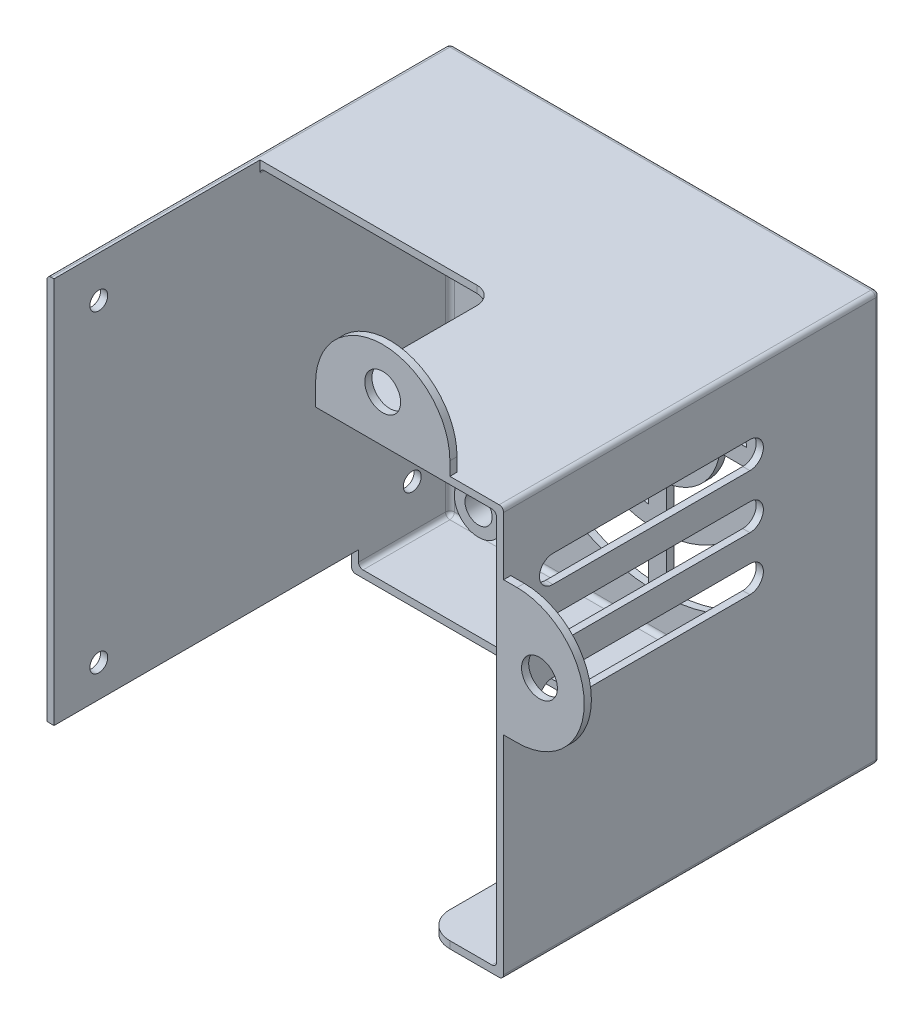
from build123d import *

# Parameters (mm, degrees)
CROQUIS1_W                        = 48
CROQUIS1_H                        = 45.7
SALIENTE_EXTRUIR1_DEPTH           = 42
CROQUIS2_W                        = 27
CROQUIS2_H                        = 20
CORTAR_EXTRUIR1_DEPTH             = 68.102458971
CROQUIS3_W                        = 0.8
CROQUIS3_H                        = 43.2
SALIENTE_EXTRUIR2_DEPTH           = 23
CROQUIS4_W                        = 27
CROQUIS4_H                        = 2.5
CORTAR_EXTRUIR2_DEPTH             = 11
CORTAR_EXTRUIR3_REACH             = 70.493
CROQUIS6_W                        = 26.2
CROQUIS6_H                        = 11
CROQUIS7_W                        = 31
CROQUIS7_H                        = 44.9
CORTAR_EXTRUIR4_DEPTH             = 12
CROQUIS8_W                        = 38.2
CROQUIS8_H                        = 44.1
CORTAR_EXTRUIR5_DEPTH             = 10.2
CORTAR_EXTRUIR6_REACH             = 71.353
CROQUIS9_W                        = 41.2
CROQUIS9_H                        = 44.1
CORTAR_EXTRUIR7_DEPTH             = 57.221437193
CORTAR_EXTRUIR8_DEPTH             = 57.221437193
CORTAR_EXTRUIR9_DEPTH             = 57.221437193
CORTAR_EXTRUIR10_DEPTH            = 57.221437193
CORTAR_EXTRUIR11_DEPTH            = 57.221437193
CORTAR_EXTRUIR12_DEPTH            = 57.221437193
CORTAR_EXTRUIR13_DEPTH            = 57.221437193
CORTAR_EXTRUIR14_REACH            = 71.9
CORTAR_EXTRUIR15_REACH            = 71.9
CORTAR_EXTRUIR16_REACH            = 71.9
CORTAR_EXTRUIR17_DEPTH            = 57.852528528
SALIENTE_EXTRUIR3_DEPTH           = 0.8
SALIENTE_EXTRUIR4_DEPTH           = 0.8
DI_METRO_DE_TALADRO_2_0_2_1_D     = 2
DI_METRO_DE_TALADRO_2_0_2_1_DEPTH = 0.8
DI_METRO_DE_TALADRO_4_0_4_1_D     = 4
DI_METRO_DE_TALADRO_4_0_4_1_DEPTH = 42
REDONDEO1_R                       = 0.5
REDONDEO2_R                       = 2
REDONDEO3_R                       = 3
CROQUIS33_R                       = 2.7
CROQUIS33_R_2                     = 1.5
SALIENTE_EXTRUIR5_DEPTH           = 4
SALIENTE_EXTRUIR5_2_DEPTH         = 4
CROQUIS33_R_3                     = 1.516813283
SALIENTE_EXTRUIR5_3_DEPTH         = 4
SALIENTE_EXTRUIR5_4_DEPTH         = 4


with BuildPart() as part:
    # Croquis1 → Saliente-Extruir1 (new body)
    with BuildSketch(Plane.XY.offset(42)):
        with Locations((-1.5, 0.75)):
            Rectangle(CROQUIS1_W, CROQUIS1_H)
    extrude(amount=-SALIENTE_EXTRUIR1_DEPTH)

    # Croquis2 → Cortar-Extruir1 (cut, through all)
    with BuildSketch(Plane(origin=(0, 23.6, 0), x_dir=(-1, 0, 0), z_dir=(0, 1, 0))):
        with Locations((12, 32)):
            Rectangle(CROQUIS2_W, CROQUIS2_H)
    extrude(amount=-CORTAR_EXTRUIR1_DEPTH, mode=Mode.SUBTRACT)

    # Croquis3 → Saliente-Extruir2 (add)
    with BuildSketch(Plane.XY.offset(22)):
        with Locations((-25.1, 2)):
            Rectangle(CROQUIS3_W, CROQUIS3_H)
    extrude(amount=SALIENTE_EXTRUIR2_DEPTH)

    # Croquis4 → Cortar-Extruir2 (cut)
    with BuildSketch(Plane.XY.offset(22)):
        with Locations((-12, -20.85)):
            Rectangle(CROQUIS4_W, CROQUIS4_H)
    extrude(amount=-CORTAR_EXTRUIR2_DEPTH, mode=Mode.SUBTRACT)

    # Croquis6 → Cortar-Extruir3 (cut, up to next)
    with BuildSketch(Plane(origin=(0, 22.8, 0), x_dir=(1, 0, 0), z_dir=(0, 1, 0)), mode=Mode.PRIVATE) as cortar_extruir3_sk1:
        with Locations((-11.6, -16.5)):
            Rectangle(CROQUIS6_W, CROQUIS6_H)
    cortar_extruir3_tool1 = extrude(cortar_extruir3_sk1.sketch, amount=-CORTAR_EXTRUIR3_REACH, mode=Mode.PRIVATE) & part.part
    add(cortar_extruir3_tool1.solids().sort_by_distance((-11.6, 22.8, 16.5))[0], mode=Mode.SUBTRACT)

    # Croquis7 → Cortar-Extruir4 (cut)
    with BuildSketch(Plane.ZY.offset(-1.5)):
        with Locations((26.5, 0.35)):
            Rectangle(CROQUIS7_W, CROQUIS7_H)
    extrude(amount=-CORTAR_EXTRUIR4_DEPTH, mode=Mode.SUBTRACT)

    # Croquis8 → Cortar-Extruir5 (cut)
    with BuildSketch(Plane.XY.offset(11)):
        with Locations((-5.6, 0.75)):
            Rectangle(CROQUIS8_W, CROQUIS8_H)
    extrude(amount=-CORTAR_EXTRUIR5_DEPTH, mode=Mode.SUBTRACT)

    # Croquis9 → Cortar-Extruir6 (cut, up to next)
    with BuildSketch(Plane(origin=(21.7, 0, 0), x_dir=(0, 0, -1), z_dir=(1, 0, 0)), mode=Mode.PRIVATE) as cortar_extruir6_sk1:
        with Locations((-21.4, 0.75)):
            Rectangle(CROQUIS9_W, CROQUIS9_H)
    cortar_extruir6_tool1 = extrude(cortar_extruir6_sk1.sketch, amount=-CORTAR_EXTRUIR6_REACH, mode=Mode.PRIVATE) & part.part
    add(cortar_extruir6_tool1.solids().sort_by_distance((21.7, 0.75, 21.4))[0], mode=Mode.SUBTRACT)

    # Croquis10 → Cortar-Extruir7 (cut, through all)
    with BuildSketch(Plane.XY.offset(0.8)):
        with BuildLine():
            Line((-0.5, -6.17820323), (-0.5, -9.199874371))
            ThreePointArc((-0.5, -9.199874371), (5.571067812, -6.321067812), (8.449874371, -0.25))
            Line((8.449874371, -0.25), (5.42820323, -0.25))
            ThreePointArc((5.42820323, -0.25), (3.449747468, -4.199747468), (-0.5, -6.17820323))
        make_face()
    extrude(amount=-CORTAR_EXTRUIR7_DEPTH, mode=Mode.SUBTRACT)

    # Croquis11 → Cortar-Extruir8 (cut, through all)
    with BuildSketch(Plane.XY.offset(0.8)):
        with BuildLine():
            Line((-0.5, -11.208260743), (-0.5, -17.222200756))
            ThreePointArc((-0.5, -17.222200756), (11.227922061, -11.977922061), (16.472200756, -0.25))
            Line((16.472200756, -0.25), (10.458260743, -0.25))
            ThreePointArc((10.458260743, -0.25), (6.985281374, -7.735281374), (-0.5, -11.208260743))
        make_face()
    extrude(amount=-CORTAR_EXTRUIR8_DEPTH, mode=Mode.SUBTRACT)

    # Croquis12 → Cortar-Extruir9 (cut, through all)
    with BuildSketch(Plane.XY.offset(0.8)):
        with BuildLine():
            Line((-8.42820323, -0.25), (-11.449874371, -0.25))
            ThreePointArc((-11.449874371, -0.25), (-8.571067812, -6.321067812), (-2.5, -9.199874371))
            Line((-2.5, -9.199874371), (-2.5, -6.17820323))
            ThreePointArc((-2.5, -6.17820323), (-6.449747468, -4.199747468), (-8.42820323, -0.25))
        make_face()
    extrude(amount=-CORTAR_EXTRUIR9_DEPTH, mode=Mode.SUBTRACT)

    # Croquis13 → Cortar-Extruir10 (cut, through all)
    with BuildSketch(Plane.XY.offset(0.8)):
        with BuildLine():
            Line((-13.458260743, -0.25), (-19.472200756, -0.25))
            ThreePointArc((-19.472200756, -0.25), (-14.227922061, -11.977922061), (-2.5, -17.222200756))
            Line((-2.5, -17.222200756), (-2.5, -11.208260743))
            ThreePointArc((-2.5, -11.208260743), (-9.985281374, -7.735281374), (-13.458260743, -0.25))
        make_face()
    extrude(amount=-CORTAR_EXTRUIR10_DEPTH, mode=Mode.SUBTRACT)

    # Croquis14 → Cortar-Extruir11 (cut, through all)
    with BuildSketch(Plane.XY.offset(0.8)):
        with BuildLine():
            Line((-2.5, 7.67820323), (-2.5, 10.699874371))
            ThreePointArc((-2.5, 10.699874371), (-8.571067812, 7.821067812), (-11.449874371, 1.75))
            Line((-11.449874371, 1.75), (-8.42820323, 1.75))
            ThreePointArc((-8.42820323, 1.75), (-6.449747468, 5.699747468), (-2.5, 7.67820323))
        make_face()
    extrude(amount=-CORTAR_EXTRUIR11_DEPTH, mode=Mode.SUBTRACT)

    # Croquis15 → Cortar-Extruir12 (cut, through all)
    with BuildSketch(Plane.XY.offset(0.8)):
        with BuildLine():
            Line((-2.5, 12.708260743), (-2.5, 18.722200756))
            ThreePointArc((-2.5, 18.722200756), (-14.227922061, 13.477922061), (-19.472200756, 1.75))
            Line((-19.472200756, 1.75), (-13.458260743, 1.75))
            ThreePointArc((-13.458260743, 1.75), (-9.985281374, 9.235281374), (-2.5, 12.708260743))
        make_face()
    extrude(amount=-CORTAR_EXTRUIR12_DEPTH, mode=Mode.SUBTRACT)

    # Croquis16 → Cortar-Extruir13 (cut, through all)
    with BuildSketch(Plane.XY.offset(0.8)):
        with BuildLine():
            Line((5.42820323, 1.75), (8.449874371, 1.75))
            ThreePointArc((8.449874371, 1.75), (5.571067812, 7.821067812), (-0.5, 10.699874371))
            Line((-0.5, 10.699874371), (-0.5, 7.67820323))
            ThreePointArc((-0.5, 7.67820323), (3.449747468, 5.699747468), (5.42820323, 1.75))
        make_face()
    extrude(amount=-CORTAR_EXTRUIR13_DEPTH, mode=Mode.SUBTRACT)

    # Croquis17 → Cortar-Extruir14 (cut, up to next)
    with BuildSketch(Plane(origin=(22.5, 0, 0), x_dir=(0, 0, -1), z_dir=(1, 0, 0)), mode=Mode.PRIVATE) as cortar_extruir14_sk1:
        with BuildLine():
            Line((-36.5, 1.4), (-14.5, 1.4))
            ThreePointArc((-14.5, 1.4), (-13, 2.9), (-14.5, 4.4))
            Line((-14.5, 4.4), (-36.5, 4.4))
            ThreePointArc((-36.5, 4.4), (-38, 2.9), (-36.5, 1.4))
        make_face()
    cortar_extruir14_tool1 = extrude(cortar_extruir14_sk1.sketch, amount=-CORTAR_EXTRUIR14_REACH, mode=Mode.PRIVATE) & part.part
    add(cortar_extruir14_tool1.solids().sort_by_distance((22.5, 2.9, 25.5))[0], mode=Mode.SUBTRACT)

    # Croquis18 → Cortar-Extruir15 (cut, up to next)
    with BuildSketch(Plane(origin=(22.5, 0, 0), x_dir=(0, 0, -1), z_dir=(1, 0, 0)), mode=Mode.PRIVATE) as cortar_extruir15_sk1:
        with BuildLine():
            Line((-36.5, 7.4), (-14.5, 7.4))
            ThreePointArc((-14.5, 7.4), (-13, 8.9), (-14.5, 10.4))
            Line((-14.5, 10.4), (-36.5, 10.4))
            ThreePointArc((-36.5, 10.4), (-38, 8.9), (-36.5, 7.4))
        make_face()
    cortar_extruir15_tool1 = extrude(cortar_extruir15_sk1.sketch, amount=-CORTAR_EXTRUIR15_REACH, mode=Mode.PRIVATE) & part.part
    add(cortar_extruir15_tool1.solids().sort_by_distance((22.5, 8.9, 25.5))[0], mode=Mode.SUBTRACT)

    # Croquis19 → Cortar-Extruir16 (cut, up to next)
    with BuildSketch(Plane(origin=(22.5, 0, 0), x_dir=(0, 0, -1), z_dir=(1, 0, 0)), mode=Mode.PRIVATE) as cortar_extruir16_sk1:
        with BuildLine():
            Line((-36.5, 13.4), (-14.5, 13.4))
            ThreePointArc((-14.5, 13.4), (-13, 14.9), (-14.5, 16.4))
            Line((-14.5, 16.4), (-36.5, 16.4))
            ThreePointArc((-36.5, 16.4), (-38, 14.9), (-36.5, 13.4))
        make_face()
    cortar_extruir16_tool1 = extrude(cortar_extruir16_sk1.sketch, amount=-CORTAR_EXTRUIR16_REACH, mode=Mode.PRIVATE) & part.part
    add(cortar_extruir16_tool1.solids().sort_by_distance((22.5, 14.9, 25.5))[0], mode=Mode.SUBTRACT)

    # Croquis20 → Cortar-Extruir17 (cut, through all)
    with BuildSketch(Plane(origin=(0, 0, 0), x_dir=(-1, 0, 0), z_dir=(0, 0, -1))):
        with BuildLine():
            Line((-16.472200756, 1.75), (-10.458260743, 1.75))
            ThreePointArc((-10.458260743, 1.75), (-6.985281374, 9.235281374), (0.5, 12.708260743))
            Line((0.5, 12.708260743), (0.5, 18.722200756))
            ThreePointArc((0.5, 18.722200756), (-11.227922061, 13.477922061), (-16.472200756, 1.75))
        make_face()
    extrude(amount=-CORTAR_EXTRUIR17_DEPTH, mode=Mode.SUBTRACT)

    # Croquis21 → Saliente-Extruir3 (add)
    with BuildSketch(Plane.XY.offset(42)):
        with BuildLine():
            Line((1.5, 25.1), (1.5, 23.6))
            Line((1.5, 23.6), (16.5, 23.6))
            Line((16.5, 23.6), (16.5, 25.1))
            ThreePointArc((16.5, 25.1), (9, 32.6), (1.5, 25.1))
        make_face()
    extrude(amount=-SALIENTE_EXTRUIR3_DEPTH)

    # Croquis22 → Saliente-Extruir4 (add)
    with BuildSketch(Plane.XY.offset(42)):
        with BuildLine():
            Line((24, 16.6), (22.5, 16.6))
            Line((22.5, 16.6), (22.5, 1.6))
            Line((22.5, 1.6), (24, 1.6))
            ThreePointArc((24, 1.6), (31.5, 9.1), (24, 16.6))
        make_face()
    extrude(amount=-SALIENTE_EXTRUIR4_DEPTH)

    # Diámetro de taladro Ø2.0 (2)1
    with Locations(Plane(origin=(-24.7, 0, 0), x_dir=(0, 0, -1), z_dir=(1, 0, 0))):
        with Locations((-40, 19), (-40, -16), (-5, -16), (-5, 19)):
            Hole(DI_METRO_DE_TALADRO_2_0_2_1_D / 2, depth=DI_METRO_DE_TALADRO_2_0_2_1_DEPTH)

    # Diámetro de taladro Ø4.0 (4)1
    with Locations(Plane.XY.offset(42)):
        with Locations((9, 28), (26.5, 9.1)):
            Hole(DI_METRO_DE_TALADRO_4_0_4_1_D / 2, depth=DI_METRO_DE_TALADRO_4_0_4_1_DEPTH)

    # Redondeo1
    redondeo1_edges = [part.edges().sort_by_distance(p)[0] for p in [
        (21.7, 22.8, 21.4),
        (-25.5, 0.75, 0),
        (-1.5, -22.1, 0),
        (22.5, 0.75, 0),
        (-24.7, 22.8, 11.4),
        (22.5, -22.1, 21),
        (-25.5, -22.1, 5.5),
        (-25.5, 23.6, 22.5),
        (22.5, 23.6, 21),
        (-24.7, 0.75, 0.8),
        (-24.7, -21.3, 5.9),
        (-1.5, 22.8, 0.8),
        (-1.5, -21.3, 0.8),
        (-1.5, 23.6, 0),
        (21.7, -21.3, 21.4),
        (21.7, 0.75, 0.8),
    ]]
    fillet(redondeo1_edges, radius=REDONDEO1_R)

    # Redondeo2
    redondeo2_edges = [part.edges().sort_by_distance(p)[0] for p in [
        (1.5, 23.2, 22),
    ]]
    fillet(redondeo2_edges, radius=REDONDEO2_R)

    # Redondeo3
    redondeo3_edges = [part.edges().sort_by_distance(p)[0] for p in [
        (13.5, -21.7, 42),
        (13.5, -21.7, 11),
    ]]
    fillet(redondeo3_edges, radius=REDONDEO3_R)


with BuildPart() as body_2:
    # Croquis33 → Saliente-Extruir5 (new body)
    with BuildSketch(Plane.XY.offset(0.8)):
        with Locations((-17.5, 16.8)):
            Circle(CROQUIS33_R)
        with Locations((-17.5, 16.8)):
            Circle(CROQUIS33_R_2, mode=Mode.SUBTRACT)
    extrude(amount=SALIENTE_EXTRUIR5_DEPTH)


with BuildPart() as body_3:
    # Croquis33 → Saliente-Extruir5 2 (new body)
    with BuildSketch(Plane.XY.offset(0.8)):
        with Locations((14.5, 16.8)):
            Circle(CROQUIS33_R)
        with Locations((14.5, 16.8)):
            Circle(CROQUIS33_R_2, mode=Mode.SUBTRACT)
    extrude(amount=SALIENTE_EXTRUIR5_2_DEPTH)


with BuildPart() as body_4:
    # Croquis33 → Saliente-Extruir5 3 (new body)
    with BuildSketch(Plane.XY.offset(0.8)):
        with Locations((-17.5, -15.2)):
            Circle(CROQUIS33_R)
        with Locations((-17.5, -15.2)):
            Circle(CROQUIS33_R_3, mode=Mode.SUBTRACT)
    extrude(amount=SALIENTE_EXTRUIR5_3_DEPTH)


with BuildPart() as body_5:
    # Croquis33 → Saliente-Extruir5 4 (new body)
    with BuildSketch(Plane.XY.offset(0.8)):
        with Locations((14.5, -15.2)):
            Circle(CROQUIS33_R)
        with Locations((14.5, -15.2)):
            Circle(CROQUIS33_R_2, mode=Mode.SUBTRACT)
    extrude(amount=SALIENTE_EXTRUIR5_4_DEPTH)


solid = Compound([part.part, body_2.part, body_3.part, body_4.part, body_5.part])
